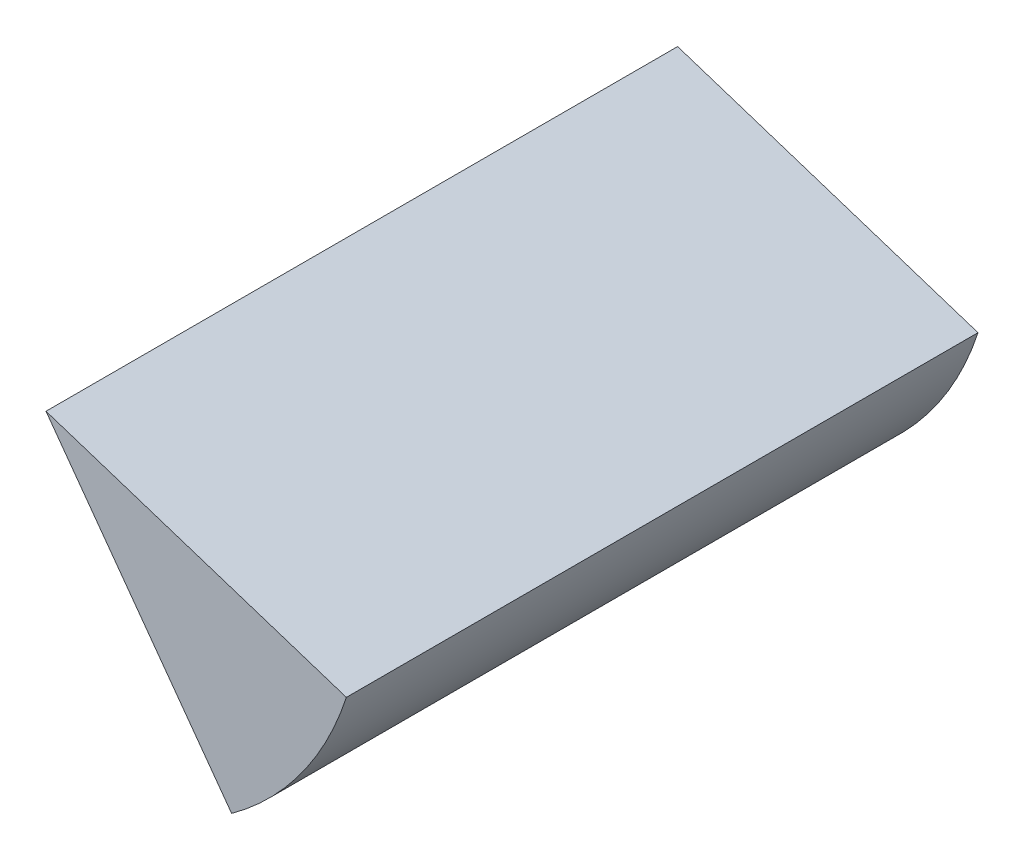
from build123d import *

# Parameters (mm, degrees)
SALIENTE_EXTRUIR1_DEPTH = 50
CROQUIS2_R              = 5.022205939
CORTAR_EXTRUIR1_DEPTH   = 10


with BuildPart() as part:
    # Croquis1 → Saliente-Extruir1 (new body)
    with BuildSketch(Plane.XY):
        with BuildLine():
            Line((0, 0), (14.694631307, -20.225424859))
            ThreePointArc((14.694631307, -20.225424859), (20.225424859, -14.694631307), (23.776412907, -7.725424859))
            Line((23.776412907, -7.725424859), (0, 0))
        make_face()
    extrude(amount=SALIENTE_EXTRUIR1_DEPTH)

    # Croquis2 → Cortar-Extruir1 (cut)
    with BuildSketch(Plane(origin=(0, 0, 0), x_dir=(-1, 0, 0), z_dir=(0, 0, -1))):
        with Locations((-15.384948943, -10.887427122)):
            Circle(CROQUIS2_R)
    extrude(amount=-CORTAR_EXTRUIR1_DEPTH, mode=Mode.SUBTRACT)


solid = part.part
